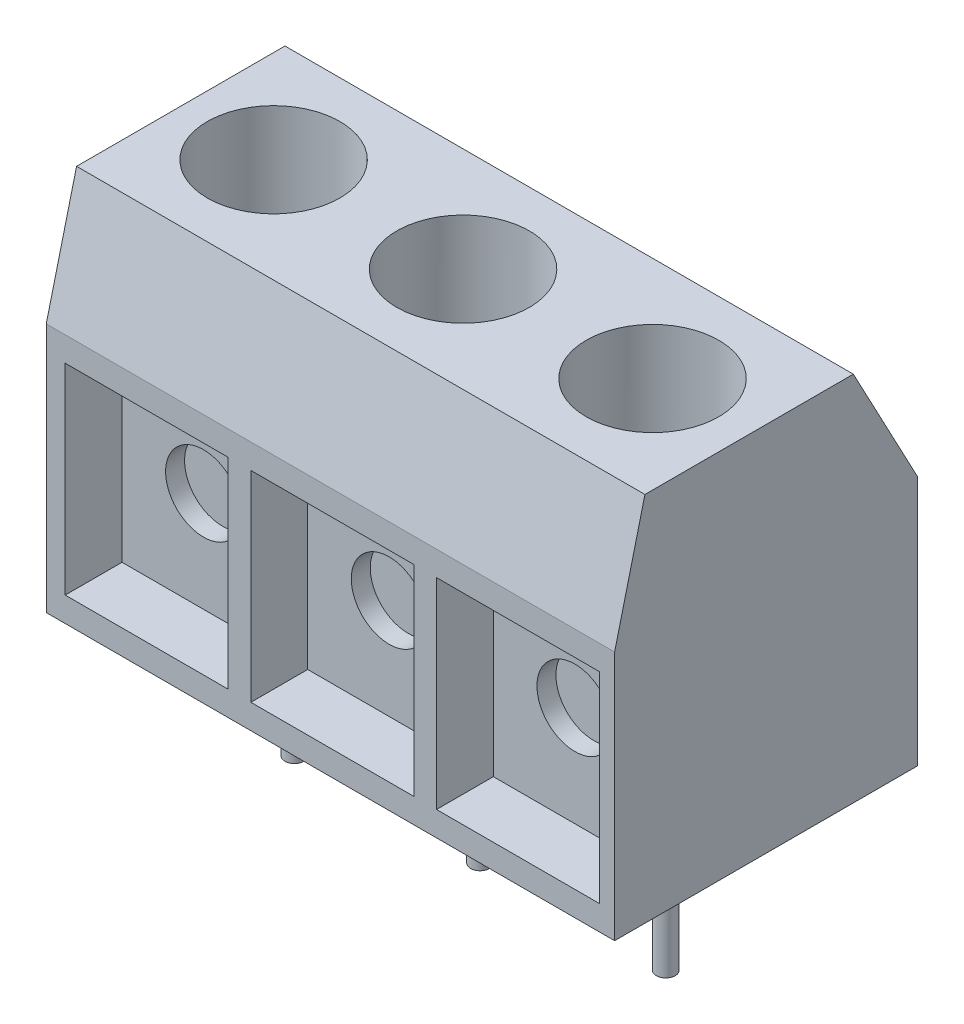
from build123d import *

# Parameters (mm, degrees)
CROQUIS1_W                          = 15
CROQUIS1_H                          = 8
SALIENTE_EXTRUIR1_DEPTH             = 6.6
SALIENTE_EXTRUIR2_REACH             = 12.762
SALIENTE_EXTRUIR2_DIRECTION_2_REACH = 12.762
CROQUIS3_R                          = 1.75
CORTAR_EXTRUIR1_DEPTH               = 3
CORTAR_EXTRUIR2_DEPTH               = 0.25
MATRIZL1_COUNT                      = 3
MATRIZL1_PITCH                      = 5
CROQUIS5_R                          = 0.25
SALIENTE_EXTRUIR3_DEPTH             = 4
MATRIZL2_COUNT                      = 3
MATRIZL2_PITCH                      = 4.9
CROQUIS6_W                          = 4.3
CROQUIS6_H                          = 5.3
CROQUIS6_R                          = 1
CORTAR_EXTRUIR3_DEPTH               = 1.5
CROQUIS6_2_R                        = 1
CORTAR_EXTRUIR4_DEPTH               = 2
MATRIZL3_COUNT                      = 3
MATRIZL3_PITCH                      = 4.9


with BuildPart() as part:
    # Croquis1 → Saliente-Extruir1 (new body)
    with BuildSketch(Plane(origin=(0, 0, 0), x_dir=(1, 0, 0), z_dir=(0, 1, 0))):
        Rectangle(CROQUIS1_W, CROQUIS1_H)
    extrude(amount=SALIENTE_EXTRUIR1_DEPTH)

    # Saliente-Extruir2: up to this face of the body (flat: up to its plane)
    saliente_extruir2_end = Plane(part.part.faces().sort_by_distance((7.5, 3.3, 0))[0])
    # Croquis2 → Saliente-Extruir2 (add, up to the picked face)
    with BuildSketch(Plane(origin=(0, 0, 0), x_dir=(0, 0, -1), z_dir=(1, 0, 0)), mode=Mode.PRIVATE) as saliente_extruir2_sk1:
        Polygon((-4, 6.6), (4, 6.6), (2.3, 9.8), (-3.2, 9.8), align=None)
    saliente_extruir2_tool1 = split(extrude(saliente_extruir2_sk1.sketch, amount=SALIENTE_EXTRUIR2_REACH, mode=Mode.PRIVATE), bisect_by=saliente_extruir2_end, keep=Keep.BOTH, mode=Mode.PRIVATE)
    add(saliente_extruir2_tool1.solids().sort_by(Axis((0, 8.101235, 0.211111), (1, 0, 0)))[0])

    # Saliente-Extruir2 direction 2: up to this face of the body (flat: up to its plane)
    saliente_extruir2_direction_2_end = Plane(part.part.faces().sort_by_distance((-7.5, 3.3, 0))[0])
    # Croquis2 → Saliente-Extruir2 direction 2 (add, up to the picked face)
    with BuildSketch(Plane(origin=(0, 0, 0), x_dir=(0, 0, -1), z_dir=(1, 0, 0)), mode=Mode.PRIVATE) as saliente_extruir2_direction_2_sk1:
        Polygon((-4, 6.6), (4, 6.6), (2.3, 9.8), (-3.2, 9.8), align=None)
    saliente_extruir2_direction_2_tool1 = split(extrude(saliente_extruir2_direction_2_sk1.sketch, amount=-SALIENTE_EXTRUIR2_DIRECTION_2_REACH, mode=Mode.PRIVATE), bisect_by=saliente_extruir2_direction_2_end, keep=Keep.BOTH, mode=Mode.PRIVATE)
    add(saliente_extruir2_direction_2_tool1.solids().sort_by(Axis((0, 8.101235, 0.211111), (-1, 0, 0)))[0])

    # Croquis3 → Cortar-Extruir1 (cut)
    with BuildSketch(Plane(origin=(0, 9.8, 0), x_dir=(1, 0, 0), z_dir=(0, 1, 0))):
        with Locations((-5.05, -0.45)):
            Circle(CROQUIS3_R)
    cortar_extruir1 = extrude(amount=-CORTAR_EXTRUIR1_DEPTH, mode=Mode.SUBTRACT)

    # Croquis4 → Cortar-Extruir2 (cut)
    with BuildSketch(Plane(origin=(0, 6.8, 0), x_dir=(1, 0, 0), z_dir=(0, 1, 0))):
        with BuildLine():
            ThreePointArc((-5.3, -2.182050808), (-5.05, -2.2), (-4.8, -2.182050808))
            Line((-4.8, -2.182050808), (-4.8, -0.7))
            Line((-4.8, -0.7), (-3.317949192, -0.7))
            ThreePointArc((-3.317949192, -0.7), (-3.304493066, -0.575321759), (-3.3, -0.45))
            ThreePointArc((-3.3, -0.45), (-3.304493066, -0.324678241), (-3.317949192, -0.2))
            Line((-3.317949192, -0.2), (-4.8, -0.2))
            Line((-4.8, -0.2), (-4.8, 1.282050808))
            ThreePointArc((-4.8, 1.282050808), (-5.05, 1.3), (-5.3, 1.282050808))
            Line((-5.3, 1.282050808), (-5.3, -0.2))
            Line((-5.3, -0.2), (-6.782050808, -0.2))
            ThreePointArc((-6.782050808, -0.2), (-6.8, -0.45), (-6.782050808, -0.7))
            Line((-6.782050808, -0.7), (-5.3, -0.7))
            Line((-5.3, -0.7), (-5.3, -2.182050808))
        make_face()
    cortar_extruir2 = extrude(amount=-CORTAR_EXTRUIR2_DEPTH, mode=Mode.SUBTRACT)

    # MatrizL1: Cortar-Extruir1, Cortar-Extruir2 ×3
    with Locations(*[(i * MATRIZL1_PITCH, 0, 0) for i in range(1, MATRIZL1_COUNT)]):
        add(cortar_extruir1, mode=Mode.SUBTRACT)
        add(cortar_extruir2, mode=Mode.SUBTRACT)

    # Croquis5 → Saliente-Extruir3 (add)
    with BuildSketch(Plane.XZ):
        with Locations((-4.95, 0)):
            Circle(CROQUIS5_R)
    saliente_extruir3 = extrude(amount=SALIENTE_EXTRUIR3_DEPTH)

    # MatrizL2: Saliente-Extruir3 ×3
    with Locations(*[(i * MATRIZL2_PITCH, 0, 0) for i in range(1, MATRIZL2_COUNT)]):
        add(saliente_extruir3)

    # Croquis6 → Cortar-Extruir3 (cut)
    with BuildSketch(Plane.XY.offset(4)):
        with Locations((-4.85, 3.3)):
            Rectangle(CROQUIS6_W, CROQUIS6_H)
        with Locations((-4.85, 3.3)):
            Circle(CROQUIS6_R, mode=Mode.SUBTRACT)
    cortar_extruir3 = extrude(amount=-CORTAR_EXTRUIR3_DEPTH, mode=Mode.SUBTRACT)

    # Croquis6<2> → Cortar-Extruir4 (cut)
    with BuildSketch(Plane.XY.offset(4)):
        with Locations((-4.85, 3.3)):
            Circle(CROQUIS6_2_R)
    cortar_extruir4 = extrude(amount=-CORTAR_EXTRUIR4_DEPTH, mode=Mode.SUBTRACT)

    # MatrizL3: Cortar-Extruir3, Cortar-Extruir4 ×3
    with Locations(*[(i * MATRIZL3_PITCH, 0, 0) for i in range(1, MATRIZL3_COUNT)]):
        add(cortar_extruir3, mode=Mode.SUBTRACT)
        add(cortar_extruir4, mode=Mode.SUBTRACT)


solid = part.part
